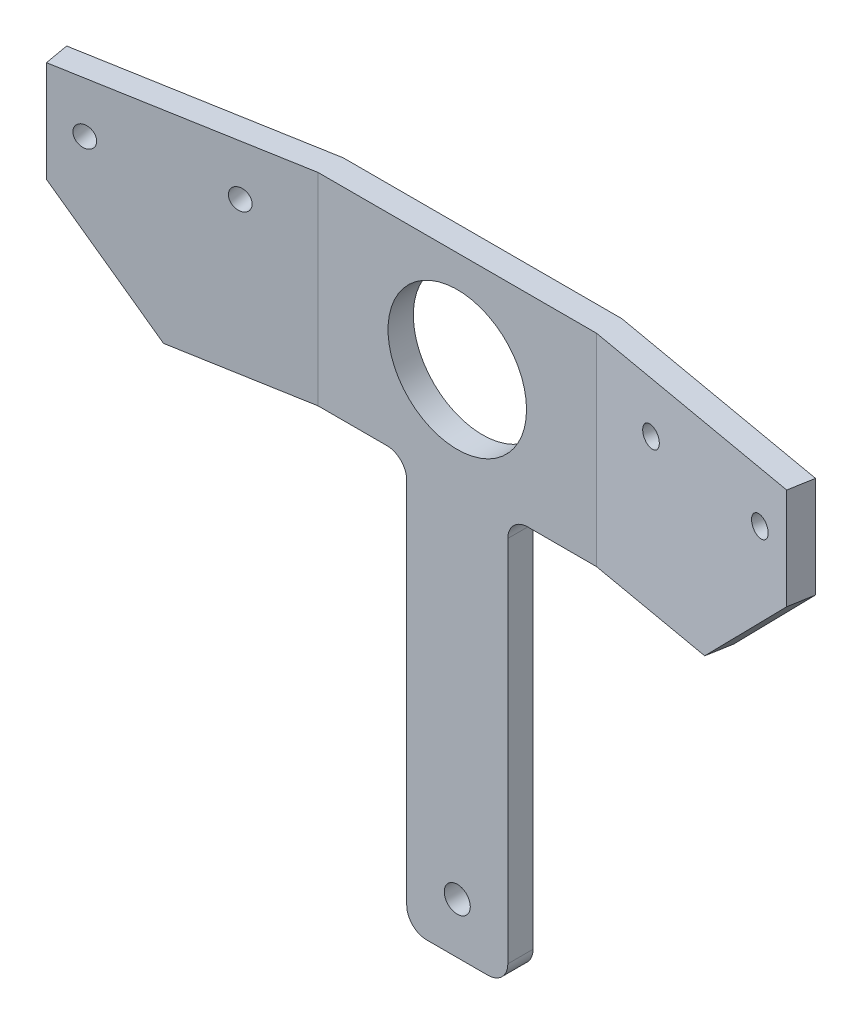
from build123d import *

# Parameters (mm, degrees)
SKETCH1_R           = 17.4
SKETCH1_R_2         = 3.265
BOSS_EXTRUDE1_DEPTH = 6.35
FILLET2_R           = 5
BOSS_EXTRUDE2_DEPTH = 50.8
CUT_EXTRUDE4_DEPTH  = 181.692673495
SKETCH8_R           = 2.575
CUT_EXTRUDE6_DEPTH  = 10


with BuildPart() as part:
    # Sketch1 → Boss-Extrude1 (new body)
    with BuildSketch(Plane.XY):
        Polygon((-12.7, 0), (12.7, 0), (12.7, 102.57), (35, 102.57), (35, 153.37), (-35, 153.37), (-35, 102.57), (-12.7, 102.57), align=None)
        with Locations((0, 127.97)):
            Circle(SKETCH1_R, mode=Mode.SUBTRACT)
        with Locations((0, 12.7)):
            Circle(SKETCH1_R_2, mode=Mode.SUBTRACT)
    extrude(amount=BOSS_EXTRUDE1_DEPTH)

    # Fillet2
    fillet2_edges = [part.edges().sort_by_distance(p)[0] for p in [
        (12.7, 102.57, 3.175),
        (12.7, 0, 3.175),
        (-12.7, 0, 3.175),
        (-12.7, 102.57, 3.175),
    ]]
    fillet(fillet2_edges, radius=FILLET2_R)

    # Sketch2 → Boss-Extrude2 (add)
    with BuildSketch(Plane(origin=(0, 153.37, 0), x_dir=(1, 0, 0), z_dir=(0, 1, 0))):
        Polygon((-35, 0), (-94.088465181, -10.41889066), (-93.002551226, -16.577414731), (-35, -6.35), align=None)
    boss_extrude2 = extrude(amount=-BOSS_EXTRUDE2_DEPTH)

    # Sketch6 → Cut-Extrude4 (cut, symmetric)
    with BuildSketch(Plane(origin=(0.030534819, 0, 0.173171563), x_dir=(0.9848077530122079, 0, -0.17364817766693147), z_dir=(0.17364817766693147, 0, 0.9848077530122079))):
        Polygon((-94.468271355, 102.57), (-94.468271355, 127.97), (-69.068271355, 102.57), align=None)
    cut_extrude4 = extrude(amount=CUT_EXTRUDE4_DEPTH, both=True, mode=Mode.SUBTRACT)

    # Mirror1: Boss-Extrude2, Cut-Extrude4 across plane
    add(boss_extrude2.mirror(Plane(origin=(0, 0, 0), x_dir=(0, 0, 1), z_dir=(1, 0, 0))))
    add(cut_extrude4.mirror(Plane(origin=(0, 0, 0), x_dir=(0, 0, 1), z_dir=(1, 0, 0))), mode=Mode.SUBTRACT)

    # Sketch8 → Cut-Extrude6 (cut)
    with BuildSketch(Plane(origin=(1.055379136, 0, -5.985352508), x_dir=(-0.9848077530122079, 0, -0.17364817766693139), z_dir=(0.17364817766693139, 0, -0.9848077530122079))):
        with Locations((-86.162231322, 140.67)):
            Circle(SKETCH8_R)
        with Locations((-52.434701963, 140.67)):
            Circle(SKETCH8_R)
    cut_extrude6 = extrude(amount=-CUT_EXTRUDE6_DEPTH, mode=Mode.SUBTRACT)

    # Mirror2: Cut-Extrude6 across plane
    add(cut_extrude6.mirror(Plane(origin=(0, 0, 0), x_dir=(0, 0, 1), z_dir=(1, 0, 0))), mode=Mode.SUBTRACT)


solid = part.part
